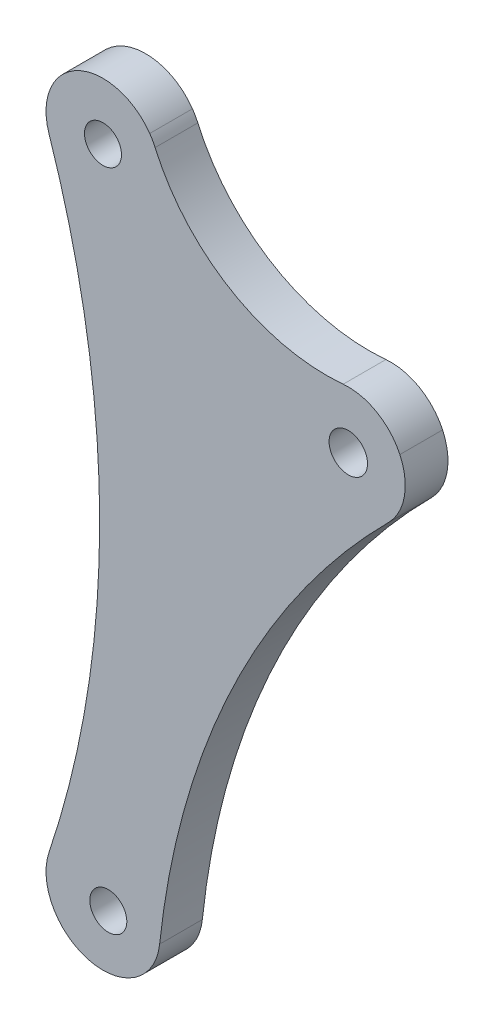
from build123d import *

# Parameters (mm, degrees)
SKETCH_1_R      = 1.3
SKETCH_1_R_2    = 1.35
EXTRUDE_1_DEPTH = 3


with BuildPart() as part:
    # 草图1 → 凸台-拉伸1 (new body)
    with BuildSketch(Plane.XY.offset(3)):
        with BuildLine():
            Line((-3.313115848, 16.021732214), (-3.311115848, 16.021732214))
            add(Edge.make_bspline(
                [(-3.311115848, 16.021732214), (-3.305738612, 16.005657169), (-3.30036747, 15.989580634), (-3.295002421, 15.973502613)],
                knots=[0, 0, 0, 0, 1, 1, 1, 1], degree=3))
            ThreePointArc((-3.295002421, 15.973502613), (0.247391506, -5.861355765), (-3.313115848, -27.693267786))
            ThreePointArc((-3.313115848, -27.693267786), (-3.460091003, -29.647679281), (-2.661550551, -31.43755613))
            ThreePointArc((-2.661550551, -31.43755613), (-0.621865458, -32.807647593), (1.833911351, -32.726246371))
            ThreePointArc((1.833911351, -32.726246371), (3.626794929, -31.434157055), (4.459911351, -29.387246371))
            ThreePointArc((4.459911351, -29.387246371), (9.614888081, -11.161248479), (20.542617881, 4.309546771))
            ThreePointArc((20.542617881, 4.309546771), (21.651368965, 6.44631062), (21.333617881, 8.832546771))
            ThreePointArc((21.333617881, 8.832546771), (19.703322731, 10.604311941), (17.351617881, 11.120546771))
            ThreePointArc((17.351617881, 11.120546771), (9.493211165, 12.888433489), (4.140617881, 18.907546771))
            ThreePointArc((4.140617881, 18.907546771), (3.968487676, 19.251416126), (3.76413819, 19.577170986))
            ThreePointArc((3.76413819, 19.577170986), (-1.314904342, 20.865715039), (-3.313115848, 16.021732214))
        make_face()
        with Locations(Location((0.853283407, -29.166236957, 0), (0, 0, 180))):
            Circle(SKETCH_1_R, mode=Mode.SUBTRACT)
        with Locations(Location((0.480884152, 17.291232214, 0), (0, 0, 180))):
            Circle(SKETCH_1_R, mode=Mode.SUBTRACT)
        with Locations(Location((17.711384152, 7.136232214, 0), (0, 0, 180))):
            Circle(SKETCH_1_R_2, mode=Mode.SUBTRACT)
    extrude(amount=-EXTRUDE_1_DEPTH)


solid = part.part
